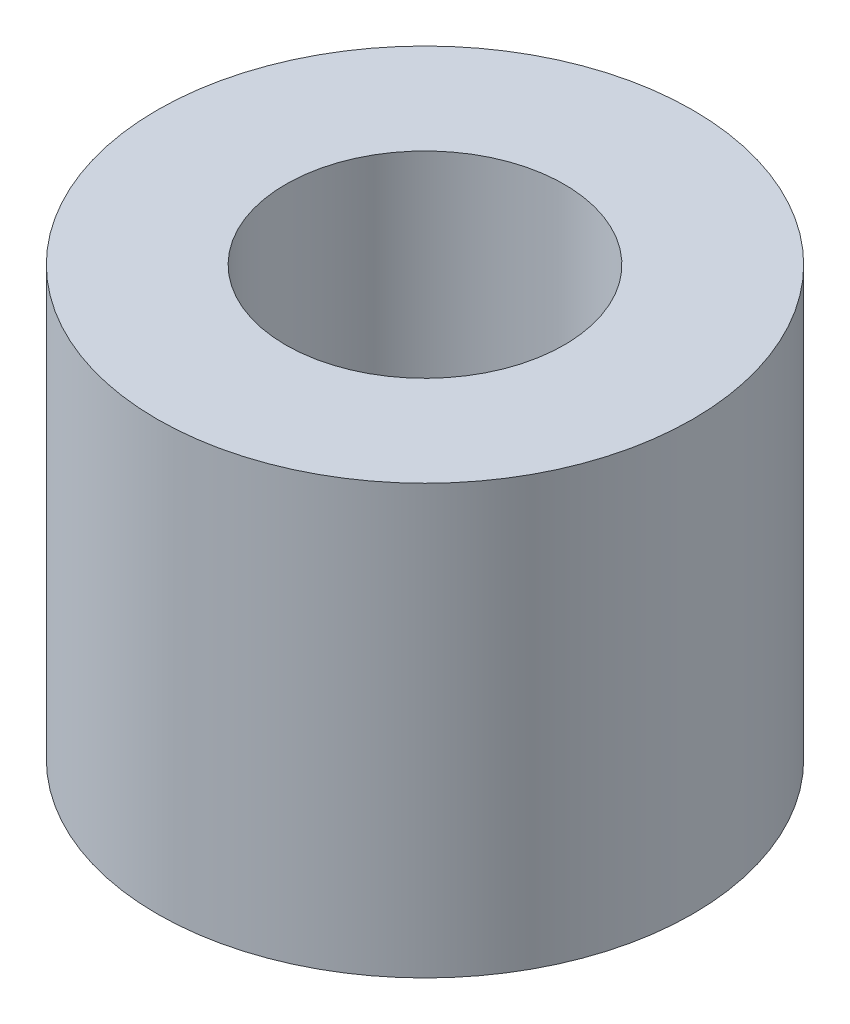
from build123d import *

# Parameters (mm, degrees)
SKETCH1_R           = 5
SKETCH1_R_2         = 2.6
BOSS_EXTRUDE1_DEPTH = 8


with BuildPart() as part:
    # Sketch1 → Boss-Extrude1 (new body)
    with BuildSketch(Plane(origin=(0, 0, 0), x_dir=(1, 0, 0), z_dir=(0, 1, 0))):
        with Locations(Location((0, 0, 0), (0, 0, 270))):
            Circle(SKETCH1_R)
        with Locations(Location((0, 0, 0), (0, 0, 270))):
            Circle(SKETCH1_R_2, mode=Mode.SUBTRACT)
    extrude(amount=BOSS_EXTRUDE1_DEPTH)


solid = part.part
